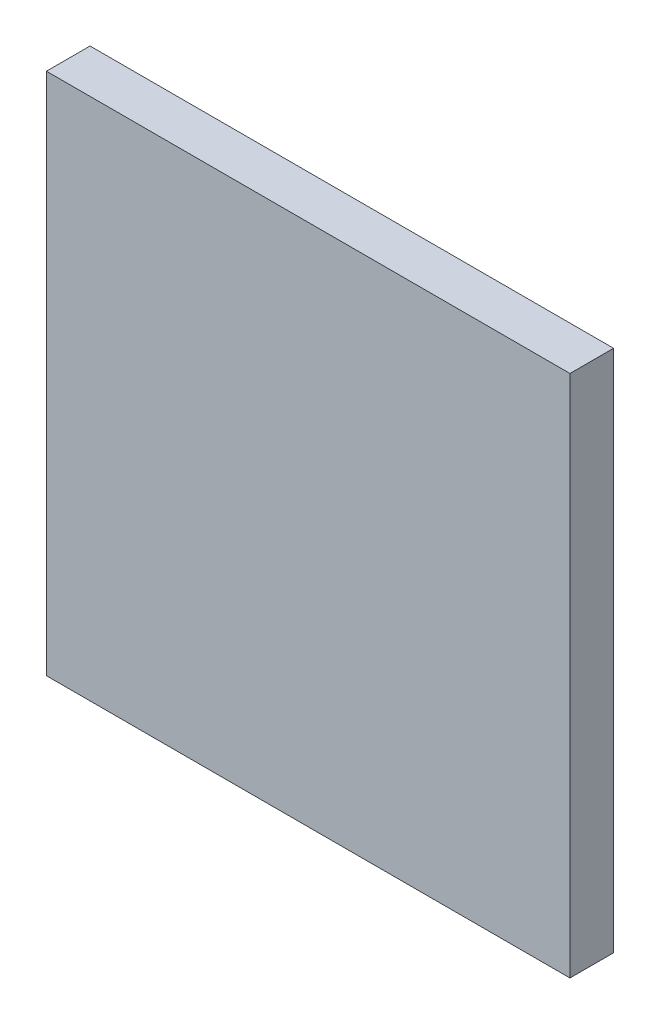
from build123d import *

# Parameters (mm, degrees)
SKETCH1_W      = 6
SKETCH1_H      = 6
EXTRUDE1_DEPTH = 0.5


with BuildPart() as part:
    # Sketch1 → Extrude1 (new body)
    with BuildSketch(Plane.XY):
        with Locations((3, 3)):
            Rectangle(SKETCH1_W, SKETCH1_H)
    extrude(amount=-EXTRUDE1_DEPTH)


solid = part.part
